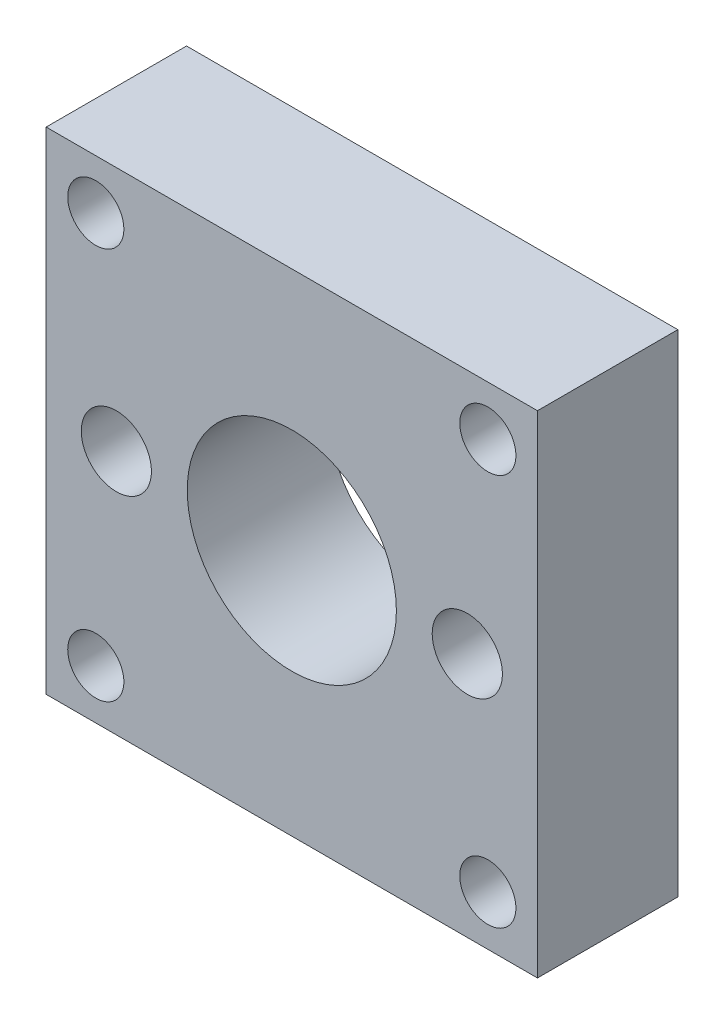
from build123d import *

# Parameters (mm, degrees)
SKETCH1_W           = 35
SKETCH1_H           = 35
SKETCH1_R           = 7.45
SKETCH1_R_2         = 2
SKETCH1_R_3         = 2.5
BOSS_EXTRUDE1_DEPTH = 10


with BuildPart() as part:
    # Sketch1 → Boss-Extrude1 (new body)
    with BuildSketch(Plane.XY):
        with Locations((2.777777778, 2.470273614)):
            Rectangle(SKETCH1_W, SKETCH1_H)
        with Locations((2.777777778, 2.592592593)):
            Circle(SKETCH1_R, mode=Mode.SUBTRACT)
        with Locations((16.742243872, -11.49419248)):
            Circle(SKETCH1_R_2, mode=Mode.SUBTRACT)
        with Locations(Location((16.742243872, 16.434739708, 0), (0, 0, 180))):
            Circle(SKETCH1_R_2, mode=Mode.SUBTRACT)
        with Locations((-11.186688316, 16.434739708)):
            Circle(SKETCH1_R_2, mode=Mode.SUBTRACT)
        with Locations(Location((-11.186688316, -11.49419248, 0), (0, 0, 180))):
            Circle(SKETCH1_R_2, mode=Mode.SUBTRACT)
        with Locations(Location((15.277777778, 2.470273614, 0), (0, 0, 180))):
            Circle(SKETCH1_R_3, mode=Mode.SUBTRACT)
        with Locations((-9.722222222, 2.470273614)):
            Circle(SKETCH1_R_3, mode=Mode.SUBTRACT)
    extrude(amount=BOSS_EXTRUDE1_DEPTH)


solid = part.part
